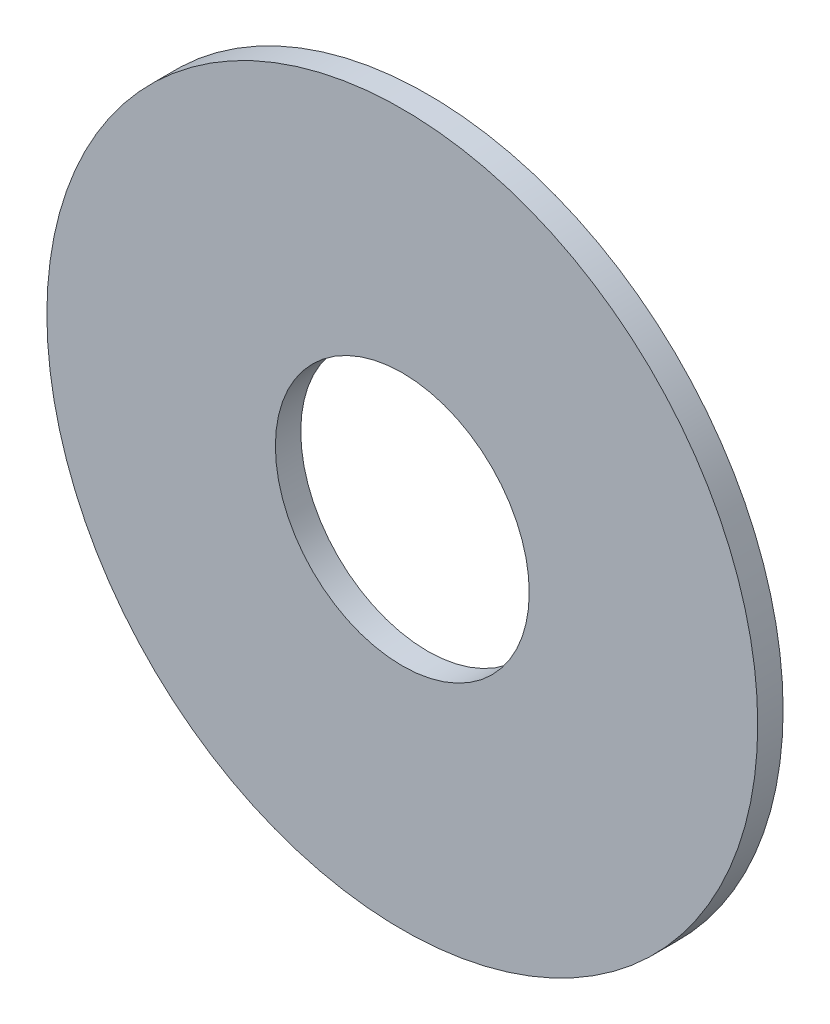
from build123d import *

# Parameters (mm, degrees)
SKETCH_1_R      = 140
SKETCH_1_R_2    = 50
EXTRUDE_1_DEPTH = 10


with BuildPart() as part:
    # 草图1 → 凸台-拉伸1 (new body)
    with BuildSketch(Plane.XY):
        Circle(SKETCH_1_R)
        Circle(SKETCH_1_R_2, mode=Mode.SUBTRACT)
    extrude(amount=EXTRUDE_1_DEPTH)


solid = part.part
